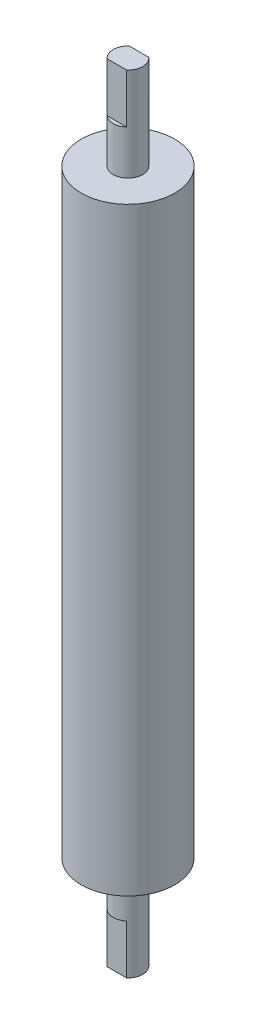
from build123d import *

# Parameters (mm, degrees)
BOSS_EXTRUDE1_DEPTH      = 20.32
BOSS_EXTRUDE1_DEPTH_BACK = 20.32
SKETCH1_R                = 3.175
SKETCH2_R                = 1
BOSS_EXTRUDE2_DEPTH      = 6.35
CUT_EXTRUDE1_DEPTH       = 6.35


with BuildPart() as part:
    # Sketch1 → Boss-Extrude1 (new, two sides: drawn at the far end of the back side and taken through both)
    with BuildSketch(Plane(origin=(0, 0, 0), x_dir=(1, 0, 0), z_dir=(0, 1, 0)).offset(-BOSS_EXTRUDE1_DEPTH_BACK)):
        Circle(SKETCH1_R)
    extrude(amount=BOSS_EXTRUDE1_DEPTH + BOSS_EXTRUDE1_DEPTH_BACK)

    # Sketch2 → Boss-Extrude2 (add)
    with BuildSketch(Plane(origin=(0, 20.32, 0), x_dir=(1, 0, 0), z_dir=(0, 1, 0))):
        Circle(SKETCH2_R)
    boss_extrude2 = extrude(amount=BOSS_EXTRUDE2_DEPTH)

    # Sketch3 → Cut-Extrude1 (cut)
    with BuildSketch(Plane(origin=(0, 23.320000096, 0), x_dir=(1, 0, 0), z_dir=(0, 1, 0))):
        with BuildLine():
            Line((0.661437828, -0.75), (-0.661437828, -0.75))
            ThreePointArc((-0.661437828, -0.75), (0, -1), (0.661437828, -0.75))
        make_face()
        with BuildLine():
            ThreePointArc((0.661437828, 0.75), (0, 1), (-0.661437828, 0.75))
            Line((-0.661437828, 0.75), (0.661437828, 0.75))
        make_face()
    cut_extrude1 = extrude(amount=CUT_EXTRUDE1_DEPTH, mode=Mode.SUBTRACT)

    # Mirror1: Boss-Extrude2, Cut-Extrude1 across plane
    add(boss_extrude2.mirror(Plane.ZX))
    add(cut_extrude1.mirror(Plane.ZX), mode=Mode.SUBTRACT)


solid = part.part
